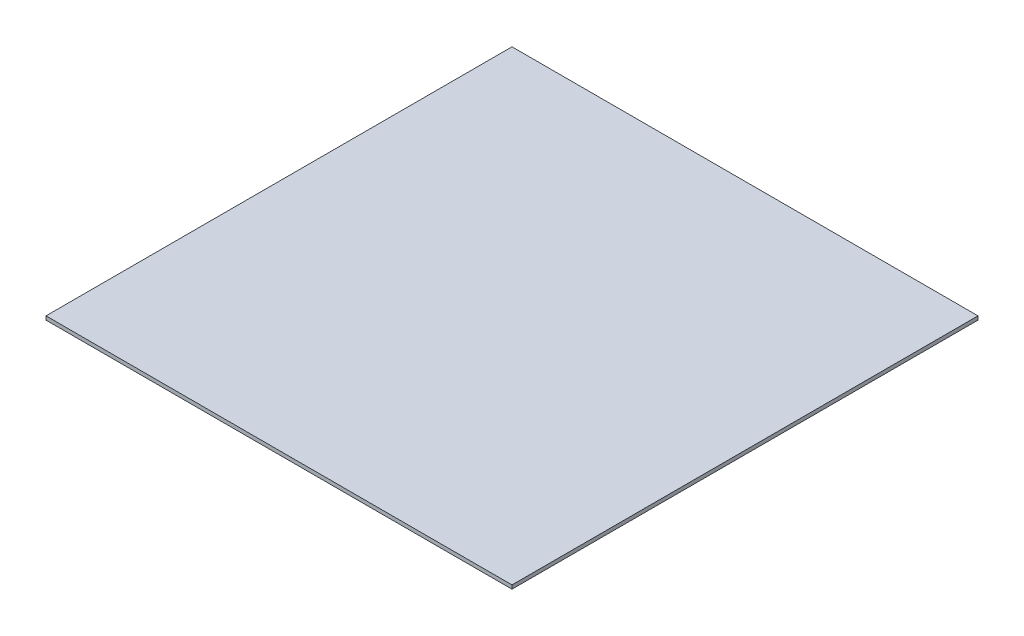
from build123d import *

# Parameters (mm, degrees)
SKETCH1_W           = 50
SKETCH1_H           = 50
BOSS_EXTRUDE1_DEPTH = 0.4


with BuildPart() as part:
    # Sketch1 → Boss-Extrude1 (new body)
    with BuildSketch(Plane(origin=(0, 0, 0), x_dir=(1, 0, 0), z_dir=(0, 1, 0))):
        with Locations((25, 25)):
            Rectangle(SKETCH1_W, SKETCH1_H)
    extrude(amount=BOSS_EXTRUDE1_DEPTH)


solid = part.part
